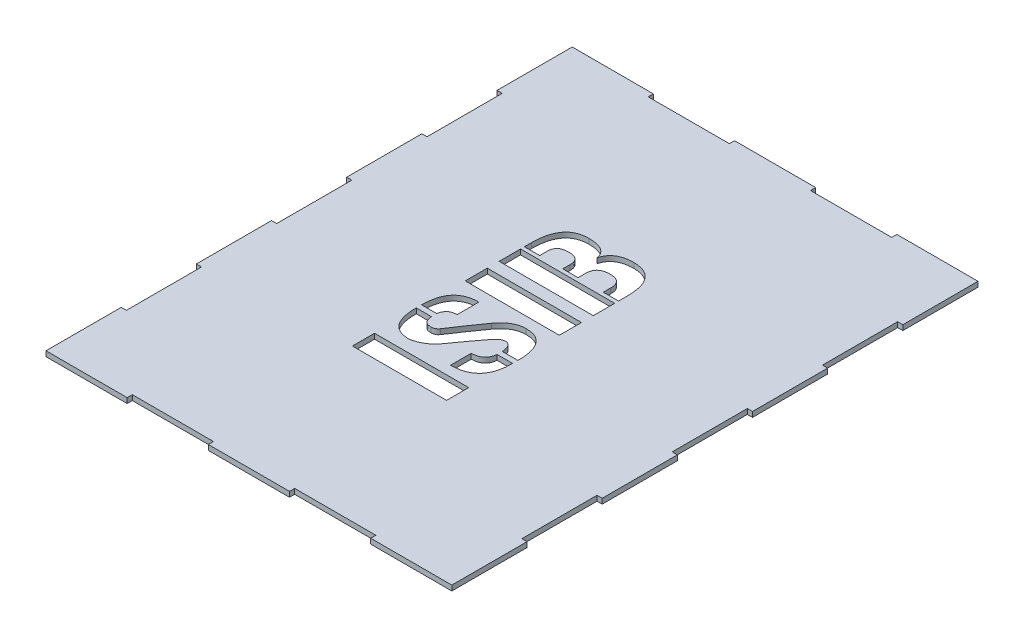
from build123d import *

# Parameters (mm, degrees)
BOSS_EXTRU_1_DEPTH      = 3
ESQUISSE3_W             = 54.751111111
ESQUISSE3_H             = 12.444338663
ESQUISSE3_H_2           = 12.852186693
ENL_V_MAT_EXTRU_4_DEPTH = 3


with BuildPart() as part:
    # Esquisse1 → Boss.-Extru.1 (new body)
    with BuildSketch(Plane(origin=(0, 0, 0), x_dir=(1, 0, 0), z_dir=(0, 1, 0))):
        Polygon((-70.8, 150), (-23.6, 150), (-23.6, 153), (23.6, 153), (23.6, 150), (70.8, 150), (70.8, 153), (118, 153), (118, 109.285714286), (115, 109.285714286), (115, 65.571428571), (118, 65.571428571), (118, 21.857142857), (115, 21.857142857), (115, -21.857142857), (118, -21.857142857), (118, -65.571428571), (115, -65.571428571), (115, -109.285714286), (118, -109.285714286), (118, -153), (70.8, -153), (70.8, -150), (23.6, -150), (23.6, -153), (-23.6, -153), (-23.6, -150), (-70.8, -150), (-70.8, -153), (-118, -153), (-118, -109.285714286), (-115, -109.285714286), (-115, -65.571428571), (-118, -65.571428571), (-118, -21.857142857), (-115, -21.857142857), (-115, 21.857142857), (-118, 21.857142857), (-118, 65.571428571), (-115, 65.571428571), (-115, 109.285714286), (-118, 109.285714286), (-118, 153), (-70.8, 153), align=None)
    extrude(amount=BOSS_EXTRU_1_DEPTH)

    # Esquisse3 → Enlèv. mat.-Extru.4 (cut)
    with BuildSketch(Plane.XZ.offset(-3)):
        with Locations((-3.922283982, -30.036515262)):
            Rectangle(ESQUISSE3_W, ESQUISSE3_H)
        with BuildLine():
            add(Edge.make_bspline(
                [(-9.015410598, -42.853885659), (-9.031150391, -43.316728138), (-9.060888408, -44.191200751), (-9.370472216, -45.413209385), (-9.892667783, -46.449051691), (-10.632758691, -47.288836312), (-11.563219862, -47.934883408), (-12.668503297, -48.391922901), (-13.950012919, -48.659807938), (-14.859859458, -48.688054244), (-15.342028815, -48.703023256)],
                knots=[0, 0, 0, 0, 1.126450489, 2.128262094, 3.046500214, 3.928555337, 4.827812714, 5.784111919, 6.825699406, 8, 8, 8, 8], degree=3))
            add(Edge.make_bspline(
                [(-15.342028815, -48.703023256), (-15.634006415, -48.700504124), (-16.19897309, -48.695629689), (-17.018938577, -48.621240575), (-17.780434229, -48.51678623), (-18.481653833, -48.36639675), (-19.123696837, -48.182059571), (-19.701584257, -47.940456772), (-20.226492281, -47.664478124), (-20.685104863, -47.33298486), (-21.093636711, -46.959302371), (-21.442159652, -46.530358645), (-21.731223409, -46.045786908), (-21.972127416, -45.51214334), (-22.161091791, -44.925283252), (-22.286704583, -44.280700576), (-22.3670125, -43.585384841), (-22.378791903, -43.102808514), (-22.384867962, -42.853885659)],
                knots=[0, 0, 0, 0, 1.326275452, 2.56629766, 3.738267977, 4.816931172, 5.822843758, 6.768617029, 7.658488254, 8.511495936, 9.332497575, 10.167890623, 11.01287611, 11.889510012, 12.823447064, 13.807454642, 14.869039735, 16, 16, 16, 16], degree=3))
            Line((-22.384867962, -42.853885659), (-22.384867962, -38.526717539))
            Line((-22.384867962, -38.526717539), (-31.297839538, -38.526717539))
            Line((-31.297839538, -38.526717539), (-31.297839538, -42.51567022))
            add(Edge.make_bspline(
                [(-31.297839538, -42.51567022), (-31.286470067, -43.281969584), (-31.264440122, -44.766782076), (-31.092874868, -46.919006552), (-30.821913569, -48.924192635), (-30.42649434, -50.78453332), (-29.909142236, -52.492827527), (-29.297652259, -54.065860284), (-28.549853779, -55.476347878), (-27.699067079, -56.748758975), (-26.730447125, -57.872206702), (-25.63815535, -58.842641644), (-24.434891934, -59.665337512), (-23.120477181, -60.334445103), (-21.691461336, -60.857745086), (-20.147157311, -61.21306706), (-18.493036143, -61.455156337), (-17.352356516, -61.475231766), (-16.764523162, -61.485577358)],
                knots=[0, 0, 0, 0, 1.348403593, 2.612721077, 3.796937302, 4.907113116, 5.955645974, 6.935208058, 7.87229249, 8.759196998, 9.62378342, 10.475214115, 11.323318974, 12.181918061, 13.06433851, 13.994218773, 14.96634859, 16, 16, 16, 16], degree=3))
            add(Edge.make_bspline(
                [(-16.764523162, -61.485577358), (-16.329952823, -61.480451692), (-15.483059506, -61.470462762), (-14.248629281, -61.375575854), (-13.08521367, -61.243146917), (-11.995389303, -61.04323447), (-10.977002602, -60.787537192), (-10.031905685, -60.465402829), (-9.148656012, -60.106518966), (-8.353297092, -59.659809119), (-7.618616933, -59.17858999), (-6.972053338, -58.62008017), (-6.374061186, -58.027222477), (-5.869522649, -57.356703274), (-5.439615392, -56.62979061), (-5.06712185, -55.854127704), (-4.779856405, -55.014720523), (-4.64652467, -54.430850195), (-4.578819835, -54.13436531)],
                knots=[0, 0, 0, 0, 1.336709555, 2.604987699, 3.807044104, 4.937539428, 6.011335436, 7.033953189, 8.007781935, 8.939170191, 9.836065292, 10.704667458, 11.563086222, 12.42205034, 13.277554673, 14.158233318, 15.064764973, 16, 16, 16, 16], degree=3))
            add(Edge.make_bspline(
                [(-4.578819835, -54.13436531), (-4.491879819, -54.454566741), (-4.320985272, -55.083974012), (-3.966227319, -55.984644928), (-3.55022711, -56.831646224), (-3.062734049, -57.625828442), (-2.487891755, -58.349428039), (-1.859575356, -59.035413067), (-1.15183194, -59.660553453), (-0.37183736, -60.228427302), (0.476962722, -60.741649938), (1.407540153, -61.17376459), (2.406231943, -61.555834987), (3.480782785, -61.863775549), (4.630347529, -62.086489178), (5.845755865, -62.253496157), (7.133773981, -62.370580939), (8.0177719, -62.377365136), (8.472317116, -62.380853521)],
                knots=[0, 0, 0, 0, 0.947032714, 1.861544699, 2.759429606, 3.639813547, 4.516931504, 5.394816016, 6.293749125, 7.20865331, 8.147410683, 9.121750415, 10.134854125, 11.198949791, 12.309605597, 13.476148485, 14.702254151, 16, 16, 16, 16], degree=3))
            add(Edge.make_bspline(
                [(8.472317116, -62.380853521), (9.076681385, -62.370265176), (10.253572459, -62.349646272), (11.957509664, -62.109847164), (13.552523979, -61.753726379), (15.02195666, -61.220033116), (16.379500377, -60.550638902), (17.622525608, -59.735508098), (18.73491253, -58.751026772), (19.751034934, -57.636936607), (20.622234958, -56.350404092), (21.381325717, -54.925072202), (22.028350487, -53.356177937), (22.552282578, -51.636897961), (22.956898772, -49.773338159), (23.238843553, -47.761597426), (23.422516263, -45.602801364), (23.442804329, -44.110987104), (23.453271573, -43.341313792)],
                knots=[0, 0, 0, 0, 1.047343257, 2.03951324, 2.978253131, 3.876822709, 4.743472182, 5.598327865, 6.445997312, 7.313237983, 8.2064557, 9.132606385, 10.109731425, 11.144688295, 12.24555226, 13.413347029, 14.665465391, 16, 16, 16, 16], degree=3))
            Line((23.453271573, -43.341313792), (23.453271573, -38.526717539))
            Line((23.453271573, -38.526717539), (14.540299997, -38.526717539))
            Line((14.540299997, -38.526717539), (14.540299997, -43.132416021))
            add(Edge.make_bspline(
                [(14.540299997, -43.132416021), (14.534101606, -43.394552914), (14.522145447, -43.900192265), (14.443499868, -44.636253482), (14.304929433, -45.318343131), (14.115998638, -45.956204937), (13.868721906, -46.539832223), (13.568815085, -47.076786556), (13.2039388, -47.558263215), (12.790011142, -47.996180719), (12.31530932, -48.376116078), (11.792517914, -48.707905525), (11.213201075, -48.989429426), (10.571423759, -49.200447046), (9.884754789, -49.382141608), (9.143171038, -49.513235863), (8.344112504, -49.57690768), (7.792659511, -49.591006497), (7.507408362, -49.598299419)],
                knots=[0, 0, 0, 0, 1.148438306, 2.215237972, 3.238005946, 4.19390407, 5.124748563, 6.009448666, 6.881052057, 7.764678133, 8.642674052, 9.537336239, 10.472929392, 11.456035513, 12.491924319, 13.583363736, 14.749941917, 16, 16, 16, 16], degree=3))
            add(Edge.make_bspline(
                [(7.507408362, -49.598299419), (7.198852685, -49.592312577), (6.603883058, -49.580768505), (5.739844678, -49.499567504), (4.935529204, -49.371514282), (4.186673883, -49.19950323), (3.503932456, -48.953204702), (2.871537365, -48.671202046), (2.307517729, -48.317133382), (1.78562013, -47.930285211), (1.343391385, -47.47150959), (0.960555419, -46.964654602), (0.626957283, -46.414189883), (0.358886408, -45.801765382), (0.153586041, -45.136947113), (0.003095523, -44.421205446), (-0.086343071, -43.655284393), (-0.096973104, -43.12602735), (-0.102439021, -42.853885659)],
                knots=[0, 0, 0, 0, 1.270824048, 2.450454696, 3.570883244, 4.62429611, 5.609164742, 6.556381062, 7.469914868, 8.346775612, 9.225654939, 10.08337405, 10.959383472, 11.870463737, 12.829422856, 13.820521909, 14.879321756, 16, 16, 16, 16], degree=3))
            Line((-0.102439021, -42.853885659), (-0.102439021, -38.526717539))
            Line((-0.102439021, -38.526717539), (-9.015410598, -38.526717539))
            Line((-9.015410598, -38.526717539), (-9.015410598, -42.853885659))
        make_face()
        with Locations((-3.922283982, -10.504573644)):
            Rectangle(ESQUISSE3_W, ESQUISSE3_H_2)
        with BuildLine():
            add(Edge.make_bspline(
                [(-16.65510052, 15.289327358), (-17.100961833, 15.300899579), (-17.951394795, 15.322972357), (-19.150202533, 15.589432331), (-20.207012747, 16.003290407), (-21.115016445, 16.597648436), (-21.85203287, 17.378321549), (-22.452892677, 18.311518664), (-22.877896255, 19.423932524), (-23.031057685, 20.230078737), (-23.111036405, 20.651036822)],
                knots=[0, 0, 0, 0, 1.146310254, 2.186464707, 3.144243253, 4.056076246, 4.955955139, 5.889247823, 6.897795239, 8, 8, 8, 8], degree=3))
            Line((-23.111036405, 20.651036822), (-31.934480365, 20.651036822))
            add(Edge.make_bspline(
                [(-31.934480365, 20.651036822), (-31.923777654, 19.924476594), (-31.903021651, 18.515442298), (-31.721907346, 16.471645194), (-31.428353012, 14.56603331), (-31.013286912, 12.798310812), (-30.47760815, 11.168898439), (-29.824247002, 9.679028853), (-29.043661506, 8.333855923), (-28.144195485, 7.129906153), (-27.122328806, 6.066566875), (-25.979197247, 5.144113019), (-24.71502119, 4.364886742), (-23.333945298, 3.722940121), (-21.82764221, 3.242572699), (-20.210826758, 2.881128496), (-18.470928676, 2.673932197), (-17.27239199, 2.648955079), (-16.65510052, 2.636090924)],
                knots=[0, 0, 0, 0, 1.289238775, 2.500249228, 3.638012133, 4.708531138, 5.719009175, 6.678003018, 7.590420387, 8.47312942, 9.33880455, 10.200871848, 11.072924044, 11.968099136, 12.896712023, 13.873293045, 14.904665934, 16, 16, 16, 16], degree=3))
            Line((-16.65510052, 2.636090924), (-16.65510052, 15.289327358))
        make_face()
        with BuildLine():
            add(Edge.make_bspline(
                [(6.900610074, 30.62839228), (7.489617056, 30.592381978), (8.606000118, 30.524129319), (10.171261364, 30.163580485), (11.533515865, 29.610645147), (12.686280632, 28.834222432), (13.612782658, 27.835170043), (14.304849522, 26.629332162), (14.791420506, 25.22847922), (14.926836721, 24.21616139), (14.997885591, 23.685028262)],
                knots=[0, 0, 0, 0, 1.188145499, 2.251969081, 3.222899412, 4.137068989, 5.031143387, 5.944995116, 6.921799913, 8, 8, 8, 8], degree=3))
            Line((14.997885591, 23.685028262), (24.0899124, 23.685028262))
            add(Edge.make_bspline(
                [(24.0899124, 23.685028262), (24.076406768, 24.451401941), (24.050224292, 25.9371199), (23.852914104, 28.092034058), (23.51613093, 30.097075033), (23.052844796, 31.959916937), (22.448912963, 33.673377646), (21.709342497, 35.242588768), (20.835395281, 36.660748844), (19.819142618, 37.929811714), (18.669887404, 39.049096811), (17.385071651, 40.024054468), (15.962281803, 40.840207031), (14.407096491, 41.510139553), (12.71822391, 42.025071011), (10.895188676, 42.385875831), (8.942800379, 42.623622176), (7.594358435, 42.644298048), (6.900610074, 42.654935401)],
                knots=[0, 0, 0, 0, 1.253286455, 2.429663552, 3.535169673, 4.575550807, 5.565228487, 6.501570722, 7.407519022, 8.283244269, 9.153782483, 10.024725991, 10.913964592, 11.829696041, 12.788584902, 13.795758984, 14.865958897, 16, 16, 16, 16], degree=3))
            Line((6.900610074, 42.654935401), (6.900610074, 30.62839228))
        make_face()
        with BuildLine():
            add(Edge.make_bspline(
                [(10.491662238, 2.228242894), (11.04298658, 2.239403906), (12.110514458, 2.261014944), (13.659054234, 2.491137372), (15.104643474, 2.83695632), (16.441466511, 3.353172815), (17.673175336, 3.999830031), (18.80061751, 4.791645953), (19.812654514, 5.739781208), (20.720999098, 6.829236555), (21.517007679, 8.065649624), (22.217948238, 9.436790101), (22.801793061, 10.958292002), (23.276021152, 12.623457826), (23.638146906, 14.430566234), (23.906344138, 16.37686464), (24.065499229, 18.466541392), (24.081608552, 19.908006871), (24.0899124, 20.651036822)],
                knots=[0, 0, 0, 0, 1.013344143, 1.962135607, 2.873348612, 3.742117199, 4.590610571, 5.426538211, 6.268054139, 7.134078066, 8.028979109, 8.967303576, 9.961750063, 11.021531283, 12.148290787, 13.348954412, 14.633469687, 16, 16, 16, 16], degree=3))
            Line((24.0899124, 20.651036822), (15.067518181, 20.651036822))
            add(Edge.make_bspline(
                [(15.067518181, 20.651036822), (15.01515462, 20.171852872), (14.916447482, 19.268574418), (14.616578659, 18.017195094), (14.228920144, 16.950101538), (13.727040311, 16.068953196), (13.117045346, 15.373487166), (12.389308269, 14.877234576), (11.550072817, 14.588696711), (10.958142966, 14.552242711), (10.650822445, 14.533316376)],
                knots=[0, 0, 0, 0, 1.38024027, 2.60180104, 3.678412993, 4.62372285, 5.491798379, 6.306203025, 7.120607672, 8, 8, 8, 8], degree=3))
            add(Edge.make_bspline(
                [(10.650822445, 14.533316376), (10.430439763, 14.573824754), (9.988997636, 14.654965906), (9.349015654, 14.885453564), (8.71795999, 15.169343276), (8.10640529, 15.548359805), (7.502261575, 15.991992703), (6.915385122, 16.516611188), (6.332114286, 17.101141235), (5.978177639, 17.540601433), (5.79643614, 17.766258075)],
                knots=[0, 0, 0, 0, 0.899062417, 1.800885725, 2.725075704, 3.67578471, 4.685901355, 5.733894806, 6.836386796, 8, 8, 8, 8], degree=3))
            add(Edge.make_bspline(
                [(5.79643614, 17.766258075), (5.217369897, 18.54638329), (4.079398727, 20.079472146), (2.377304033, 22.329291231), (0.747945549, 24.516843515), (-1.366733891, 27.284406178), (-3.870978843, 30.663132291), (-5.760041595, 33.401800752), (-6.687692574, 34.746662629)],
                knots=[0, 0, 0, 0, 0.829676897, 1.63046698, 2.40916943, 3.158999577, 4.604886565, 6, 6, 6, 6], degree=3))
            add(Edge.make_bspline(
                [(-6.687692574, 34.746662629), (-7.064779723, 35.194540453), (-7.810573328, 36.080342097), (-9.051534849, 37.277839203), (-10.378884124, 38.339656302), (-11.799606576, 39.254039527), (-13.294763424, 40.046519244), (-14.879216725, 40.691484034), (-16.541298986, 41.218037836), (-17.693605366, 41.445591804), (-18.276545126, 41.560708979)],
                knots=[0, 0, 0, 0, 1.021090304, 2.019487063, 3.003513278, 3.982474499, 4.963365888, 5.951872532, 6.96387371, 8, 8, 8, 8], degree=3))
            add(Edge.make_bspline(
                [(-18.276545126, 41.560708979), (-18.827665914, 41.548078624), (-19.900915055, 41.523482349), (-21.457452669, 41.311677196), (-22.909197814, 40.96694449), (-24.253031992, 40.479290872), (-25.488675171, 39.846577475), (-26.621068167, 39.077872783), (-27.643445633, 38.163949204), (-28.554970196, 37.110234189), (-29.351721388, 35.913559078), (-30.050498331, 34.584361198), (-30.633932291, 33.115846075), (-31.109905138, 31.510249222), (-31.486269365, 29.767979379), (-31.749477621, 27.882904669), (-31.910533001, 25.859737464), (-31.926329836, 24.464565673), (-31.934480365, 23.74471334)],
                knots=[0, 0, 0, 0, 1.032057551, 2.009822356, 2.936385557, 3.822657352, 4.681085569, 5.530476496, 6.379572098, 7.242662309, 8.133363753, 9.066958809, 10.050880128, 11.088511925, 12.200890842, 13.386820162, 14.651704674, 16, 16, 16, 16], degree=3))
            Line((-31.934480365, 23.74471334), (-23.111036405, 23.74471334))
            add(Edge.make_bspline(
                [(-23.111036405, 23.74471334), (-23.051188897, 24.221393315), (-22.940545214, 25.102660213), (-22.601341238, 26.287183545), (-22.178058071, 27.242438126), (-21.60572486, 27.963605218), (-20.891773182, 28.471119946), (-20.040705679, 28.802692695), (-19.052787369, 29.014380862), (-18.344089732, 29.035523138), (-17.968172226, 29.046737726)],
                knots=[0, 0, 0, 0, 1.370138154, 2.533056693, 3.507359726, 4.33558972, 5.129317878, 5.978716687, 6.927842083, 8, 8, 8, 8], degree=3))
            add(Edge.make_bspline(
                [(-17.968172226, 29.046737726), (-17.606499633, 29.025714772), (-16.907858497, 28.985104837), (-15.928733252, 28.612495843), (-15.058274384, 28.028052416), (-14.628414019, 27.472669668), (-14.4069626, 27.18655281)],
                knots=[0, 0, 0, 0, 1.033788873, 1.996964786, 2.968095166, 4, 4, 4, 4], degree=3))
            add(Edge.make_bspline(
                [(-14.4069626, 27.18655281), (-14.271633778, 26.967317518), (-13.987491862, 26.507002157), (-13.524156871, 25.785636234), (-13.011626906, 24.995511801), (-12.240311869, 23.834051596), (-11.202148231, 22.3012459), (-9.915161215, 20.394739277), (-8.572356824, 18.463670217), (-7.228463365, 16.563365915), (-5.947282722, 14.766122998), (-4.949033898, 13.365993172), (-4.238219196, 12.345161466), (-3.761491904, 11.686189939), (-3.342326198, 11.094523625), (-2.978673868, 10.585643145), (-2.682652832, 10.164641989), (-2.471527135, 9.847702877), (-2.32658476, 9.653383117), (-2.283567664, 9.549985582), (-2.270996838, 9.519769864)],
                knots=[0, 0, 0, 0, 0.648943614, 1.362548485, 2.1594644, 3.021190423, 4.874381135, 6.822591001, 8.81509086, 10.798695782, 12.685182857, 14.374582297, 15.129975421, 15.818353738, 16.423233595, 16.956265961, 17.394174834, 17.718512245, 17.917741224, 18, 18, 18, 18], degree=3))
            add(Edge.make_bspline(
                [(-2.270996838, 9.519769864), (-1.827503706, 8.940462902), (-0.967491683, 7.817083718), (0.465044262, 6.32550657), (1.961814519, 5.058868181), (3.533491808, 4.023855687), (5.177285189, 3.216712126), (6.891838665, 2.653362983), (8.668710564, 2.283397543), (9.879694327, 2.246758401), (10.491662238, 2.228242894)],
                knots=[0, 0, 0, 0, 1.144115968, 2.218644253, 3.237911778, 4.214895148, 5.164306381, 6.102155965, 7.0409288, 8, 8, 8, 8], degree=3))
        make_face()
        with Locations((-3.922283982, 55.069431525)):
            Rectangle(ESQUISSE3_W, ESQUISSE3_H_2)
    extrude(amount=ENL_V_MAT_EXTRU_4_DEPTH, mode=Mode.SUBTRACT)


solid = part.part
